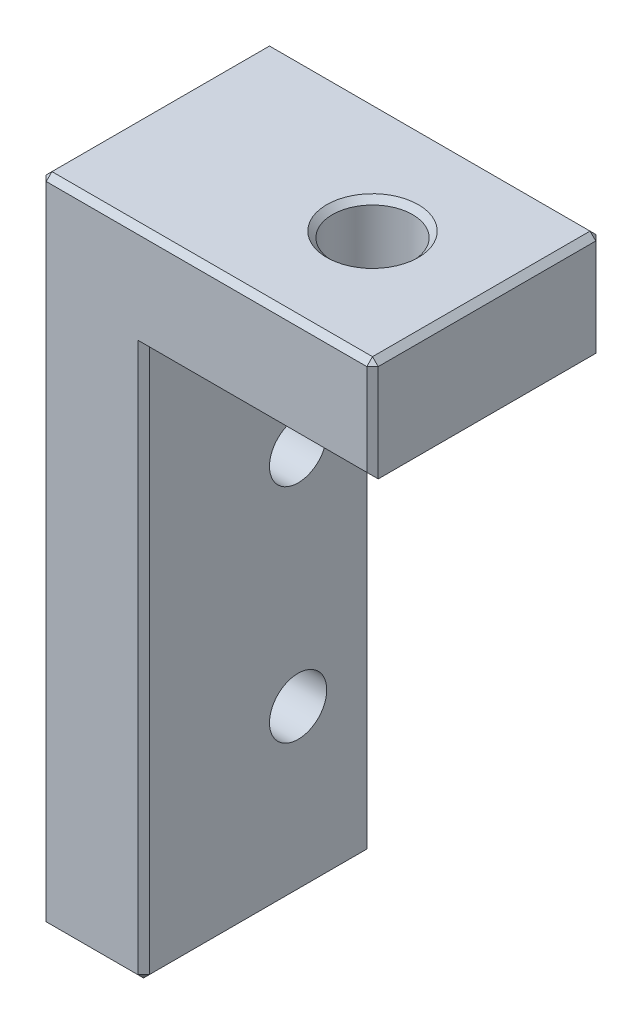
from build123d import *

# Parameters (mm, degrees)
BOSS_EXTRUDE1_DEPTH = 10
SKETCH2_R           = 1.75
CUT_EXTRUDE1_DEPTH  = 10
SKETCH3_R           = 1.25
CUT_EXTRUDE2_DEPTH  = 10
CHAMFER1_SIZE       = 0.25


with BuildPart() as part:
    # Sketch1 → Boss-Extrude1 (new body)
    with BuildSketch(Plane.XY):
        Polygon((0, 0), (0, 28.5), (14.5, 28.5), (14.5, 24), (4.5, 24), (4.5, 0), align=None)
    extrude(amount=BOSS_EXTRUDE1_DEPTH)

    # Sketch2 → Cut-Extrude1 (cut)
    with BuildSketch(Plane.XZ.offset(-24)):
        with Locations((9.5, 5)):
            Circle(SKETCH2_R)
    extrude(amount=-CUT_EXTRUDE1_DEPTH, mode=Mode.SUBTRACT)

    # Sketch3 → Cut-Extrude2 (cut)
    with BuildSketch(Plane(origin=(4.5, 0, 0), x_dir=(0, 0, -1), z_dir=(1, 0, 0))):
        with Locations(Location((-3.25, 7.15, 0), (0, 0, 90))):
            Circle(SKETCH3_R)
        with Locations(Location((-3.25, 16.85, 0), (0, 0, 90))):
            Circle(SKETCH3_R)
    extrude(amount=-CUT_EXTRUDE2_DEPTH, mode=Mode.SUBTRACT)

    # Chamfer1
    chamfer1_edges = [part.edges().sort_by_distance(p)[0] for p in [
        (0, 0, 5),
        (0, 28.5, 5),
        (14.5, 28.5, 5),
        (4.5, 0, 5),
        (9.5, 24, 10),
        (14.5, 26.25, 10),
        (7.75, 28.5, 5),
        (7.25, 28.5, 10),
        (7.75, 24, 5),
        (0, 14.25, 10),
        (0, 5.9, 3.25),
        (0, 15.6, 3.25),
        (2.25, 0, 10),
        (0, 14.25, 0),
        (7.25, 28.5, 0),
        (14.5, 26.25, 0),
        (9.5, 24, 0),
        (4.5, 12, 0),
        (2.25, 0, 0),
        (4.5, 12, 10),
    ]]
    chamfer(chamfer1_edges, length=CHAMFER1_SIZE)


solid = part.part
